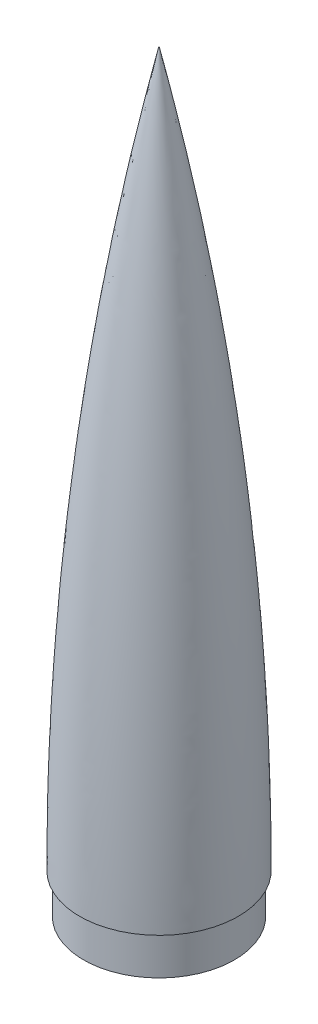
from build123d import *


with BuildPart() as part:
    # Sketch1 → Revolve1 (revolve)
    with BuildSketch(Plane.XY, mode=Mode.PRIVATE) as revolve1_sk:
        with BuildLine():
            Line((-25.4, 0), (-24.1554, 0))
            Line((-24.1554, 0), (-24.1554, -12.7))
            Line((-24.1554, -12.7), (0, -12.7))
            Line((0, -12.7), (0, 228.6))
            ThreePointArc((0, 228.6), (-19.030521289, 115.003391254), (-25.4, 0))
        make_face()
    revolve(revolve1_sk.sketch.rotate(Axis((0, -12.7, 0), (0, 1, 0)), 270), axis=Axis((0, -12.7, 0), (0, 1, 0)))


solid = part.part
